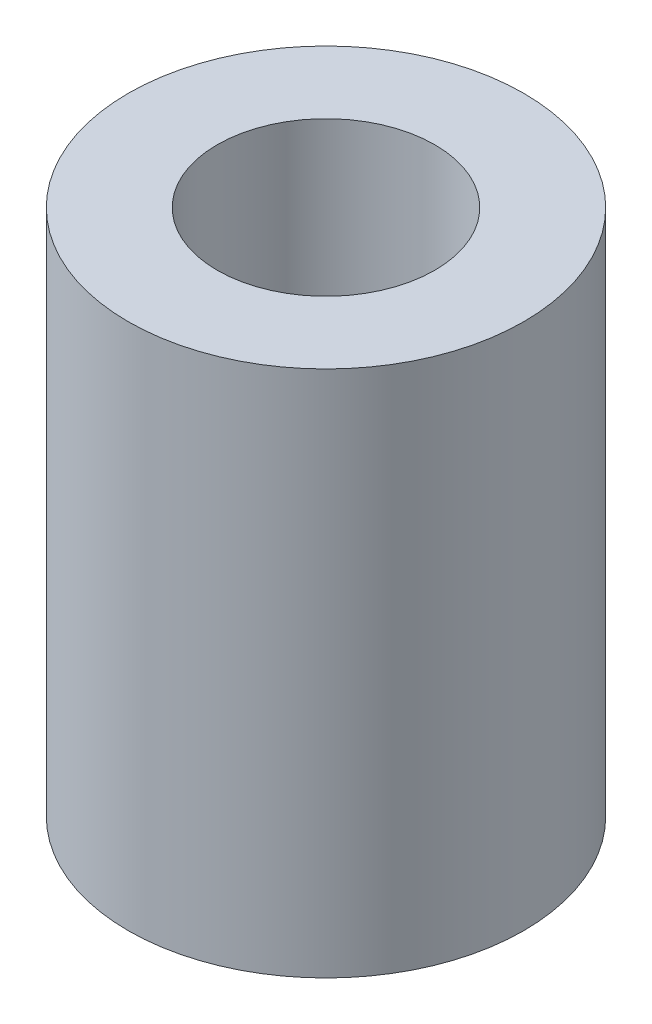
from build123d import *

# Parameters (mm, degrees)
SKETCH_1_R      = 3
SKETCH_1_R_2    = 1.65
EXTRUDE_1_DEPTH = 8


with BuildPart() as part:
    # 草图1 → 凸台-拉伸1 (new body)
    with BuildSketch(Plane(origin=(0, 0, 0), x_dir=(1, 0, 0), z_dir=(0, 1, 0))):
        with Locations(Location((0, 0, 0), (0, 0, 270))):
            Circle(SKETCH_1_R)
        with Locations(Location((0, 0, 0), (0, 0, 270))):
            Circle(SKETCH_1_R_2, mode=Mode.SUBTRACT)
    extrude(amount=EXTRUDE_1_DEPTH)


solid = part.part
